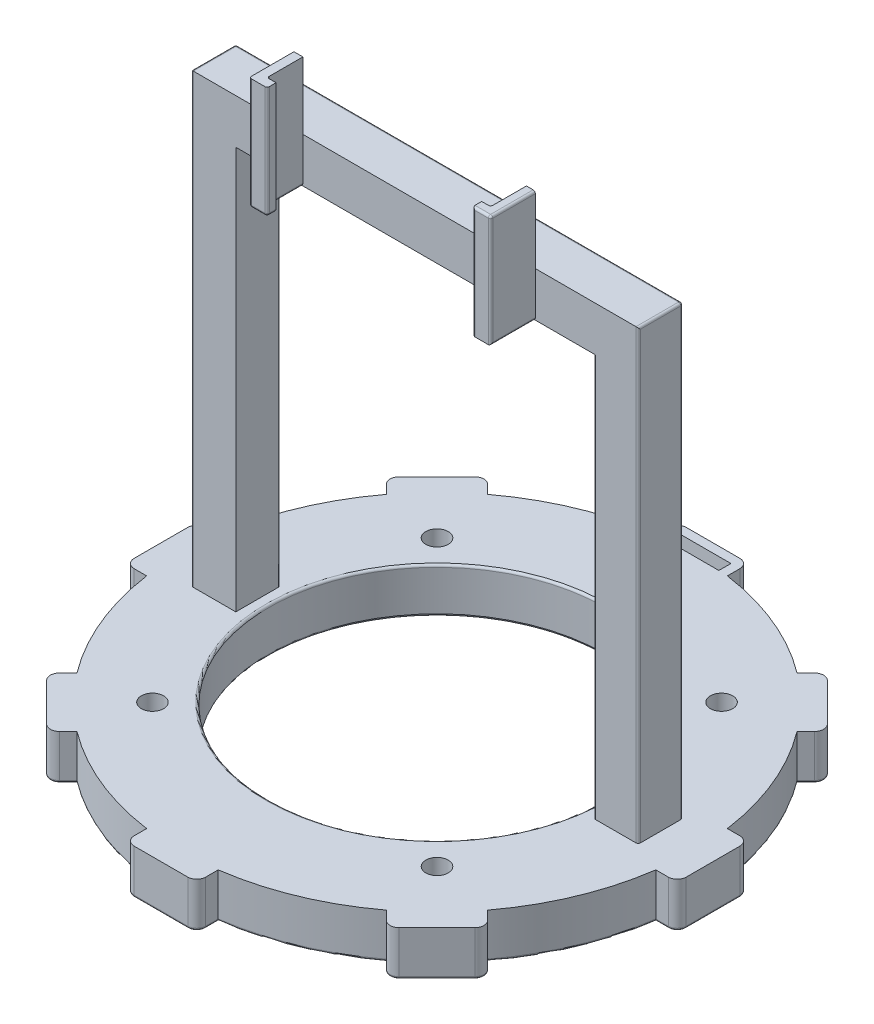
from build123d import *

# Parameters (mm, degrees)
BOSS_EXTRUDE1_DEPTH = 10
SKETCH3_R           = 37.663730654
CUT_EXTRUDE1_DEPTH  = 88.885394502
SKETCH14_R          = 2.5
CUT_EXTRUDE2_DEPTH  = 88.885394514
CIRPATTERN2_COUNT   = 4
BOSS_EXTRUDE2_DEPTH = 5
SKETCH17_W          = 2
SKETCH17_H          = 2
BOSS_EXTRUDE4_DEPTH = 25
FILLET4_R           = 0.5
FILLET5_R           = 0.5


with BuildPart() as part:
    # Sketch1 → Boss-Extrude1 (new body)
    with BuildSketch(Plane(origin=(0, 0, 0), x_dir=(1, 0, 0), z_dir=(0, 1, 0))):
        with BuildLine():
            Line((-8, 56.940758688), (-8, 59.740758688))
            ThreePointArc((-8, 59.740758688), (-7.414213562, 61.154972251), (-6, 61.740758688))
            Line((-6, 61.740758688), (6, 61.740758688))
            ThreePointArc((6, 61.740758688), (7.414213562, 61.154972251), (8, 59.740758688))
            Line((8, 59.740758688), (8, 56.940758688))
            ThreePointArc((8, 56.940758688), (22.004297361, 53.123073119), (34.606342345, 45.920050844))
            Line((34.606342345, 45.920050844), (36.586241332, 47.899949831))
            ThreePointArc((36.586241332, 47.899949831), (38.000454895, 48.485736269), (39.414668457, 47.899949831))
            Line((39.414668457, 47.899949831), (47.899949831, 39.414668457))
            ThreePointArc((47.899949831, 39.414668457), (48.485736269, 38.000454895), (47.899949831, 36.586241332))
            Line((47.899949831, 36.586241332), (45.920050844, 34.606342345))
            ThreePointArc((45.920050844, 34.606342345), (53.123073119, 22.004297361), (56.940758688, 8))
            Line((56.940758688, 8), (59.740758688, 8))
            ThreePointArc((59.740758688, 8), (61.154972251, 7.414213562), (61.740758688, 6))
            Line((61.740758688, 6), (61.740758688, -6))
            ThreePointArc((61.740758688, -6), (61.154972251, -7.414213562), (59.740758688, -8))
            Line((59.740758688, -8), (56.940758688, -8))
            ThreePointArc((56.940758688, -8), (53.123073119, -22.004297361), (45.920050844, -34.606342345))
            Line((45.920050844, -34.606342345), (47.899949831, -36.586241332))
            ThreePointArc((47.899949831, -36.586241332), (48.485736269, -38.000454895), (47.899949831, -39.414668457))
            Line((47.899949831, -39.414668457), (39.414668457, -47.899949831))
            ThreePointArc((39.414668457, -47.899949831), (38.000454895, -48.485736269), (36.586241332, -47.899949831))
            Line((36.586241332, -47.899949831), (34.606342345, -45.920050844))
            ThreePointArc((34.606342345, -45.920050844), (22.004297361, -53.123073119), (8, -56.940758688))
            Line((8, -56.940758688), (8, -59.740758688))
            ThreePointArc((8, -59.740758688), (7.414213562, -61.154972251), (6, -61.740758688))
            Line((6, -61.740758688), (-6, -61.740758688))
            ThreePointArc((-6, -61.740758688), (-7.414213562, -61.154972251), (-8, -59.740758688))
            Line((-8, -59.740758688), (-8, -56.940758688))
            ThreePointArc((-8, -56.940758688), (-22.004297361, -53.123073119), (-34.606342345, -45.920050844))
            Line((-34.606342345, -45.920050844), (-36.586241332, -47.899949831))
            ThreePointArc((-36.586241332, -47.899949831), (-38.000454895, -48.485736269), (-39.414668457, -47.899949831))
            Line((-39.414668457, -47.899949831), (-47.899949831, -39.414668457))
            ThreePointArc((-47.899949831, -39.414668457), (-48.485736269, -38.000454895), (-47.899949831, -36.586241332))
            Line((-47.899949831, -36.586241332), (-45.920050844, -34.606342345))
            ThreePointArc((-45.920050844, -34.606342345), (-53.123073119, -22.004297361), (-56.940758688, -8))
            Line((-56.940758688, -8), (-59.740758688, -8))
            ThreePointArc((-59.740758688, -8), (-61.154972251, -7.414213562), (-61.740758688, -6))
            Line((-61.740758688, -6), (-61.740758688, 6))
            ThreePointArc((-61.740758688, 6), (-61.154972251, 7.414213562), (-59.740758688, 8))
            Line((-59.740758688, 8), (-56.940758688, 8))
            ThreePointArc((-56.940758688, 8), (-53.123073119, 22.004297361), (-45.920050844, 34.606342345))
            Line((-45.920050844, 34.606342345), (-47.899949831, 36.586241332))
            ThreePointArc((-47.899949831, 36.586241332), (-48.485736269, 38.000454895), (-47.899949831, 39.414668457))
            Line((-47.899949831, 39.414668457), (-39.414668457, 47.899949831))
            ThreePointArc((-39.414668457, 47.899949831), (-38.000454895, 48.485736269), (-36.586241332, 47.899949831))
            Line((-36.586241332, 47.899949831), (-34.606342345, 45.920050844))
            ThreePointArc((-34.606342345, 45.920050844), (-22.004297361, 53.123073119), (-8, 56.940758688))
        make_face()
    extrude(amount=BOSS_EXTRUDE1_DEPTH)

    # Sketch3 → Cut-Extrude1 (cut, through all)
    with BuildSketch(Plane(origin=(0, 10, 0), x_dir=(1, 0, 0), z_dir=(0, 1, 0))):
        with Locations(Location((0, 0, 0), (0, 0, 270))):
            Circle(SKETCH3_R)
    extrude(amount=-CUT_EXTRUDE1_DEPTH, mode=Mode.SUBTRACT)

    # Sketch7 → Cut-Loft1 section 0
    with BuildSketch(Plane.XZ):
        with BuildLine():
            Line((-6, -57.040758688), (6, -57.040758688))
            Line((6, -57.040758688), (6, -59.340758688))
            Line((6, -59.340758688), (-6, -59.340758688))
            Line((-6, -59.340758688), (-6, -57.040758688))
        make_face()
    # Sketch5 → Cut-Loft1 section 1
    with BuildSketch(Plane(origin=(0, 10, 0), x_dir=(1, 0, 0), z_dir=(0, 1, 0))):
        with BuildLine():
            Line((-6, 59.740758688), (6, 59.740758688))
            Line((6, 59.740758688), (6, 57.040758688))
            Line((6, 57.040758688), (-6, 57.040758688))
            Line((-6, 57.040758688), (-6, 59.740758688))
        make_face()
    loft(mode=Mode.SUBTRACT)

    # Sketch14 → Cut-Extrude2 (cut, through all)
    with BuildSketch(Plane.XZ):
        with Locations(Location((-31.819805153, 31.819805153, 0), (0, 0, 270))):
            Circle(SKETCH14_R)
    cut_extrude2 = extrude(amount=-CUT_EXTRUDE2_DEPTH, mode=Mode.SUBTRACT)

    # CirPattern2: Cut-Extrude2 ×4 about axis
    cirpattern2_axis = Axis((0, 0, 0), (0, 1, 0))
    for i in range(1, CIRPATTERN2_COUNT):
        add(cut_extrude2.rotate(cirpattern2_axis, i * 360 / CIRPATTERN2_COUNT), mode=Mode.SUBTRACT)

    # Sketch16 → Boss-Extrude2 (add, symmetric)
    with BuildSketch(Plane.XY):
        Polygon((-40, 10), (-50, 10), (-50, 110), (50, 110), (50, 10), (40, 10), (40, 100), (-40, 100), align=None)
    extrude(amount=BOSS_EXTRUDE2_DEPTH, both=True)

    # Sketch17 → Boss-Extrude4 (add)
    with BuildSketch(Plane.XZ.offset(-100)):
        Polygon((-27, 15), (-27, 5), (-25, 5), (-25, 13), (-25, 15), align=None)
        with Locations((-24, 14)):
            Rectangle(SKETCH17_W, SKETCH17_H)
    boss_extrude4 = extrude(amount=-BOSS_EXTRUDE4_DEPTH)

    # Mirror1: Boss-Extrude4 across plane
    add(boss_extrude4.mirror(Plane(origin=(0, 0, 0), x_dir=(0, 0, 1), z_dir=(1, 0, 0))))

    # Fillet4
    fillet4_edges = [part.edges().sort_by_distance(p)[0] for p in [
        (-27, 112.5, 15),
        (-23, 112.5, 15),
        (-25, 112.5, 13),
    ]]
    fillet(fillet4_edges, radius=FILLET4_R)

    # Fillet5
    fillet5_edges = [part.edges().sort_by_distance(p)[0] for p in [
        (0, 0, -37.663730654),
        (0, 10, -37.663730654),
        (-40, 55, -5),
        (0, 100, -5),
        (40, 55, -5),
        (50, 60, 5),
        (50, 110, 0),
        (-50, 60, 5),
        (-50, 110, 0),
        (40, 55, 5),
        (-50, 60, -5),
        (0, 110, -5),
        (50, 60, -5),
        (-27, 100, 9.75),
        (-25, 100, 8.75),
        (25, 100, 9),
        (24, 100, 13),
        (25, 112.5, 13),
        (25, 125, 15),
        (23, 112.5, 15),
        (27, 125, 10),
        (27, 112.5, 15),
        (27, 100, 10),
        (23, 100, 14),
        (-23.75, 100, 13),
        (-23, 100, 13.75),
        (-25, 100, 15),
        (-24.853553391, 100, 12.853553391),
        (35.596291839, 0, -46.910000338),
        (38.000454895, 0, -48.485736269),
        (43.657309144, 0, -43.657309144),
        (48.485736269, 0, -38.000454895),
        (46.910000338, 0, -35.596291839),
        (53.123073119, 0, -22.004297361),
        (58.340758688, 0, -8),
        (61.154972251, 0, -7.414213562),
        (61.740758688, 0, 0),
        (61.154972251, 0, 7.414213562),
        (58.340758688, 0, 8),
        (53.123073119, 0, 22.004297361),
        (46.910000338, 0, 35.596291839),
        (48.485736269, 0, 38.000454895),
        (43.657309144, 0, 43.657309144),
        (38.000454895, 0, 48.485736269),
        (35.596291839, 0, 46.910000338),
        (22.004297361, 0, 53.123073119),
        (8, 0, 58.340758688),
        (7.414213562, 0, 61.154972251),
        (0, 0, 61.740758688),
        (-7.414213562, 0, 61.154972251),
        (-8, 0, 58.340758688),
        (-22.004297361, 0, 53.123073119),
        (-35.596291839, 0, 46.910000338),
        (-38.000454895, 0, 48.485736269),
        (-43.657309144, 0, 43.657309144),
        (-48.485736269, 0, 38.000454895),
        (-46.910000338, 0, 35.596291839),
        (-53.123073119, 0, 22.004297361),
        (-58.340758688, 0, 8),
        (-61.154972251, 0, 7.414213562),
        (-61.740758688, 0, 0),
        (-61.154972251, 0, -7.414213562),
        (-58.340758688, 0, -8),
        (-53.123073119, 0, -22.004297361),
        (-46.910000338, 0, -35.596291839),
        (-48.485736269, 0, -38.000454895),
        (-43.657309144, 0, -43.657309144),
        (-38.000454895, 0, -48.485736269),
        (-35.596291839, 0, -46.910000338),
        (-22.004297361, 0, -53.123073119),
        (-8, 0, -58.340758688),
        (-7.414213562, 0, -61.154972251),
        (0, 0, -61.740758688),
        (7.414213562, 0, -61.154972251),
        (8, 0, -58.340758688),
        (22.004297361, 0, -53.123073119),
        (-26.853553391, 100, 14.853553391),
        (-23.146446609, 100, 14.853553391),
    ]]
    fillet(fillet5_edges, radius=FILLET5_R)


solid = part.part
